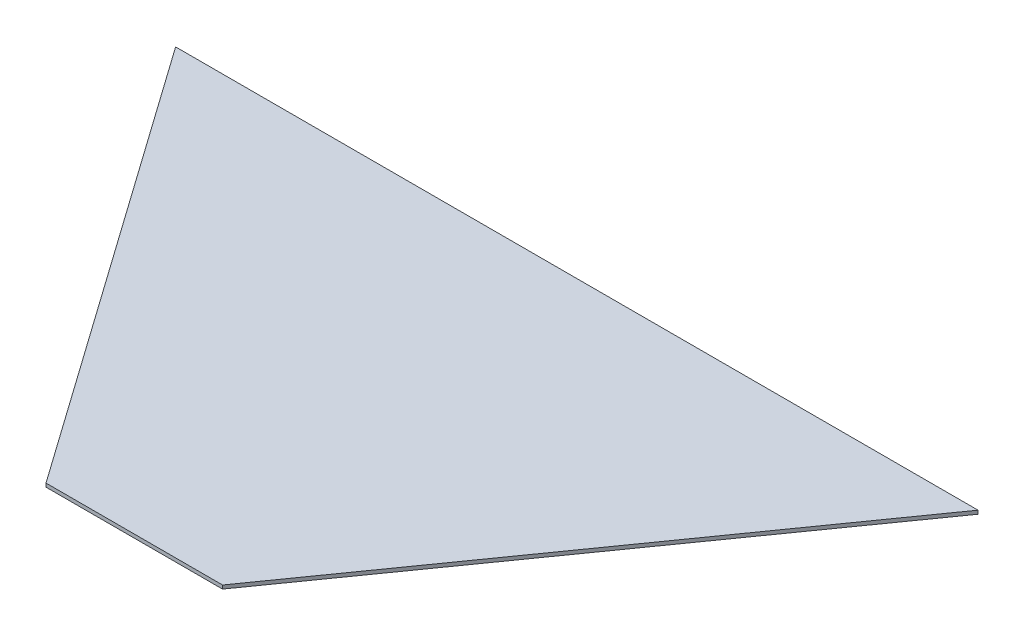
from build123d import *

# Parameters (mm, degrees)
BOSS_EXTRUDE1_DEPTH = 1.5


with BuildPart() as part:
    # Sketch1 → Boss-Extrude1 (new body)
    with BuildSketch(Plane(origin=(0, 0, 0), x_dir=(1, 0, 0), z_dir=(0, 1, 0))):
        Polygon((-168.110535, 185.436900746), (-36.986845, 0), (36.986845, 0), (168.110535, 185.436900746), align=None)
    extrude(amount=BOSS_EXTRUDE1_DEPTH)


solid = part.part
